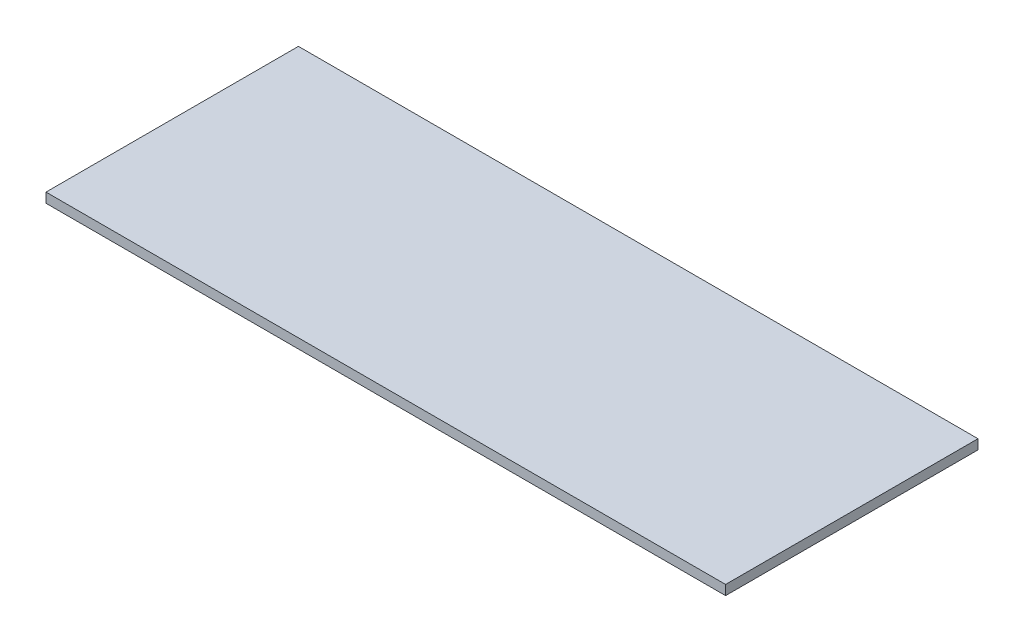
from build123d import *

# Parameters (mm, degrees)
SKETCH1_W           = 350
SKETCH1_H           = 130
BOSS_EXTRUDE1_DEPTH = 5


with BuildPart() as part:
    # Sketch1 → Boss-Extrude1 (new body)
    with BuildSketch(Plane(origin=(0, 0, 0), x_dir=(1, 0, 0), z_dir=(0, 1, 0))):
        Rectangle(SKETCH1_W, SKETCH1_H)
    extrude(amount=BOSS_EXTRUDE1_DEPTH)


solid = part.part
